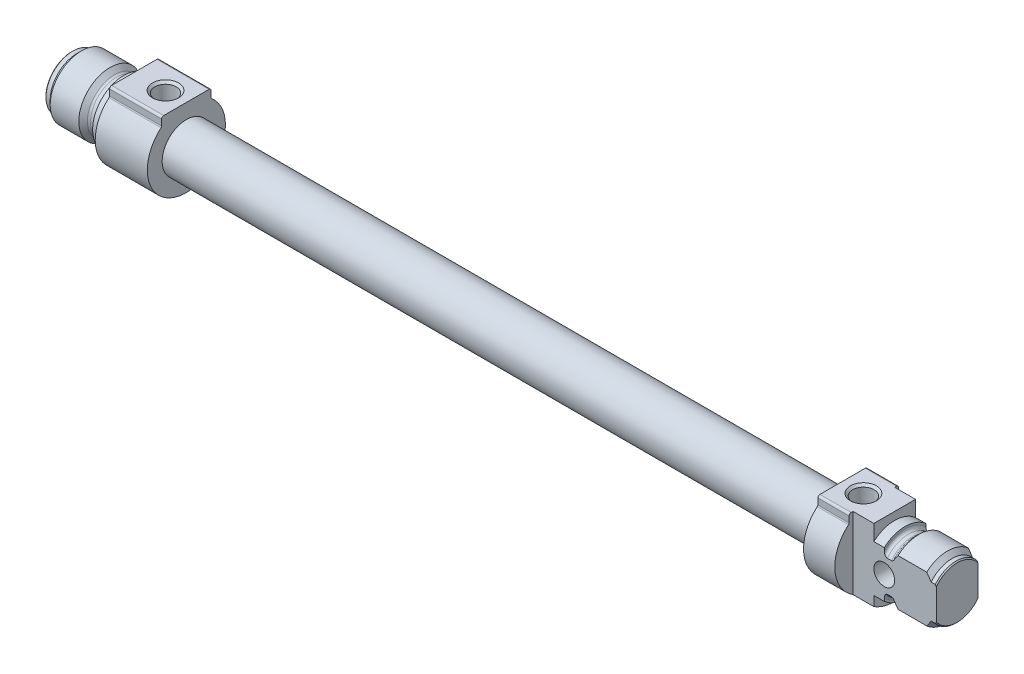
from build123d import *

# Parameters (mm, degrees)
AUFSATZ_LINEAR_AUSTRAGEN1_DEPTH      = 10
SKIZZE3_W                            = 126
SKIZZE3_H                            = 4.65
AUFSATZ_LINEAR_AUSTRAGEN2_DEPTH      = 10
SCHNITT_LINEAR_AUSTRAGEN1_DEPTH      = 7.5
SCHNITT_LINEAR_AUSTRAGEN1_DEPTH_BACK = 7.5
BOHRUNG1_D                           = 4
BOHRUNG2_D                           = 4.134
BOHRUNG2_DEPTH                       = 7.5
BOHRUNG2_CSINK_D                     = 5
BOHRUNG2_CSINK_ANGLE                 = 90
BOHRUNG3_D                           = 4.134
BOHRUNG3_DEPTH                       = 8
BOHRUNG3_CSINK_D                     = 5
BOHRUNG3_CSINK_ANGLE                 = 90
BOHRUNG3_TIP                         = 1.193383006


with BuildPart() as part:
    # Skizze1 → Rotation1 (revolve)
    with BuildSketch(Plane.XY):
        with BuildLine():
            Line((0, 0), (0, 4.95))
            Line((0, 4.95), (0.2, 5.15))
            Line((0.2, 5.15), (1, 5.15))
            Line((1, 5.15), (1.85, 6))
            Line((1.85, 6), (7.35, 6))
            Line((7.35, 6), (8.174264069, 5.175735931))
            ThreePointArc((8.174264069, 5.175735931), (8.368918078, 5.04567228), (8.598528137, 5))
            Line((8.598528137, 5), (9.4, 5))
            ThreePointArc((9.4, 5), (9.824264069, 5.175735931), (10, 5.6))
            Line((10, 5.6), (10, 6))
            Line((10, 6), (12, 6))
            Line((12, 6), (12, 0))
            Line((12, 0), (0, 0))
        make_face()
    revolve(axis=Axis((12, 0, 0), (-1, 0, 0)))

    # Skizze2 → Aufsatz-Linear austragen1 (add)
    with BuildSketch(Plane(origin=(12, 0, 0), x_dir=(0, 0, -1), z_dir=(1, 0, 0))):
        with BuildLine():
            Line((4.75, 5.944535306), (4.75, 7.1))
            ThreePointArc((4.75, 7.1), (4.632842712, 7.382842712), (4.35, 7.5))
            Line((4.35, 7.5), (-4.35, 7.5))
            ThreePointArc((-4.35, 7.5), (-4.632842712, 7.382842712), (-4.75, 7.1))
            Line((-4.75, 7.1), (-4.75, 5.944535306))
            ThreePointArc((-4.75, 5.944535306), (-4.777723274, 5.818577437), (-4.855769231, 5.715899332))
            ThreePointArc((-4.855769231, 5.715899332), (0, -7.5), (4.855769231, 5.715899332))
            ThreePointArc((4.855769231, 5.715899332), (4.777723274, 5.818577437), (4.75, 5.944535306))
        make_face()
    extrude(amount=AUFSATZ_LINEAR_AUSTRAGEN1_DEPTH)

    # Skizze3 → Rotation2 (revolve)
    with BuildSketch(Plane.XY):
        with Locations((85, 2.325)):
            Rectangle(SKIZZE3_W, SKIZZE3_H)
    revolve(axis=Axis((148, 0, 0), (-1, 0, 0)))

    # Skizze4 → Aufsatz-Linear austragen2 (add)
    with BuildSketch(Plane(origin=(148, 0, 0), x_dir=(0, 0, -1), z_dir=(1, 0, 0))):
        with BuildLine():
            Line((4.75, 5.944535306), (4.75, 7.1))
            ThreePointArc((4.75, 7.1), (4.632842712, 7.382842712), (4.35, 7.5))
            Line((4.35, 7.5), (-4.35, 7.5))
            ThreePointArc((-4.35, 7.5), (-4.632842712, 7.382842712), (-4.75, 7.1))
            Line((-4.75, 7.1), (-4.75, 5.944535306))
            ThreePointArc((-4.75, 5.944535306), (-4.777723274, 5.818577437), (-4.855769231, 5.715899332))
            ThreePointArc((-4.855769231, 5.715899332), (0, -7.5), (4.855769231, 5.715899332))
            ThreePointArc((4.855769231, 5.715899332), (4.777723274, 5.818577437), (4.75, 5.944535306))
        make_face()
    extrude(amount=AUFSATZ_LINEAR_AUSTRAGEN2_DEPTH)

    # Skizze5 → Rotation3 (revolve)
    with BuildSketch(Plane.XY):
        with BuildLine():
            Line((158, 0), (158, 6))
            Line((158, 6), (160, 6))
            Line((160, 6), (160, 5.6))
            ThreePointArc((160, 5.6), (160.175735931, 5.175735931), (160.6, 5))
            Line((160.6, 5), (161.401471863, 5))
            ThreePointArc((161.401471863, 5), (161.631081922, 5.04567228), (161.825735931, 5.175735931))
            Line((161.825735931, 5.175735931), (162.65, 6))
            Line((162.65, 6), (168.15, 6))
            Line((168.15, 6), (169, 5.15))
            Line((169, 5.15), (169.8, 5.15))
            Line((169.8, 5.15), (170, 4.95))
            Line((170, 4.95), (170, 0))
            Line((170, 0), (158, 0))
        make_face()
    revolve(axis=Axis((170, 0, 0), (-1, 0, 0)))

    # Skizze6 → Schnitt-Linear austragen1 (cut, two sides: drawn at the far end of the back side and taken through both)
    with BuildSketch(Plane(origin=(0, 0, 0), x_dir=(1, 0, 0), z_dir=(0, 1, 0)).offset(-SCHNITT_LINEAR_AUSTRAGEN1_DEPTH_BACK)):
        Polygon((154, 12), (154, 4), (170, 4), (170, -4), (154, -4), (154, -12), (178, -12), (178, 12), align=None)
    extrude(amount=SCHNITT_LINEAR_AUSTRAGEN1_DEPTH + SCHNITT_LINEAR_AUSTRAGEN1_DEPTH_BACK, mode=Mode.SUBTRACT)

    # Bohrung1 (through all)
    with Locations(Plane(origin=(0, 0, -4), x_dir=(-1, 0, 0), z_dir=(0, 0, -1))):
        with Locations((-160, 0)):
            Hole(BOHRUNG1_D / 2)

    # Bohrung2
    with Locations(Plane(origin=(0, 7.5, 0), x_dir=(1, 0, 0), z_dir=(0, 1, 0))):
        with Locations((18, 0)):
            CounterSinkHole(BOHRUNG2_D / 2, BOHRUNG2_CSINK_D / 2, depth=BOHRUNG2_DEPTH, counter_sink_angle=BOHRUNG2_CSINK_ANGLE)

    # Bohrung3
    with Locations(Plane(origin=(0, 7.5, 0), x_dir=(1, 0, 0), z_dir=(0, 1, 0))):
        with Locations((152, 0)):
            CounterSinkHole(BOHRUNG3_D / 2, BOHRUNG3_CSINK_D / 2, depth=BOHRUNG3_DEPTH, counter_sink_angle=BOHRUNG3_CSINK_ANGLE)
            with Locations((0, 0, -(BOHRUNG3_DEPTH + BOHRUNG3_TIP / 2))):  # 120° drill point
                Cone(0, BOHRUNG3_D / 2, BOHRUNG3_TIP, mode=Mode.SUBTRACT)

    # Skizze13 → Schnitt-Rotation1 (revolve, cut)
    with BuildSketch(Plane.XY):
        Polygon((-4, 0), (-4, 2), (31.5, 2), (31.5, 4), (133.5, 4), (133.5, 0), align=None)
    revolve(axis=Axis((133.5, 0, 0), (-1, 0, 0)), mode=Mode.SUBTRACT)


solid = part.part
